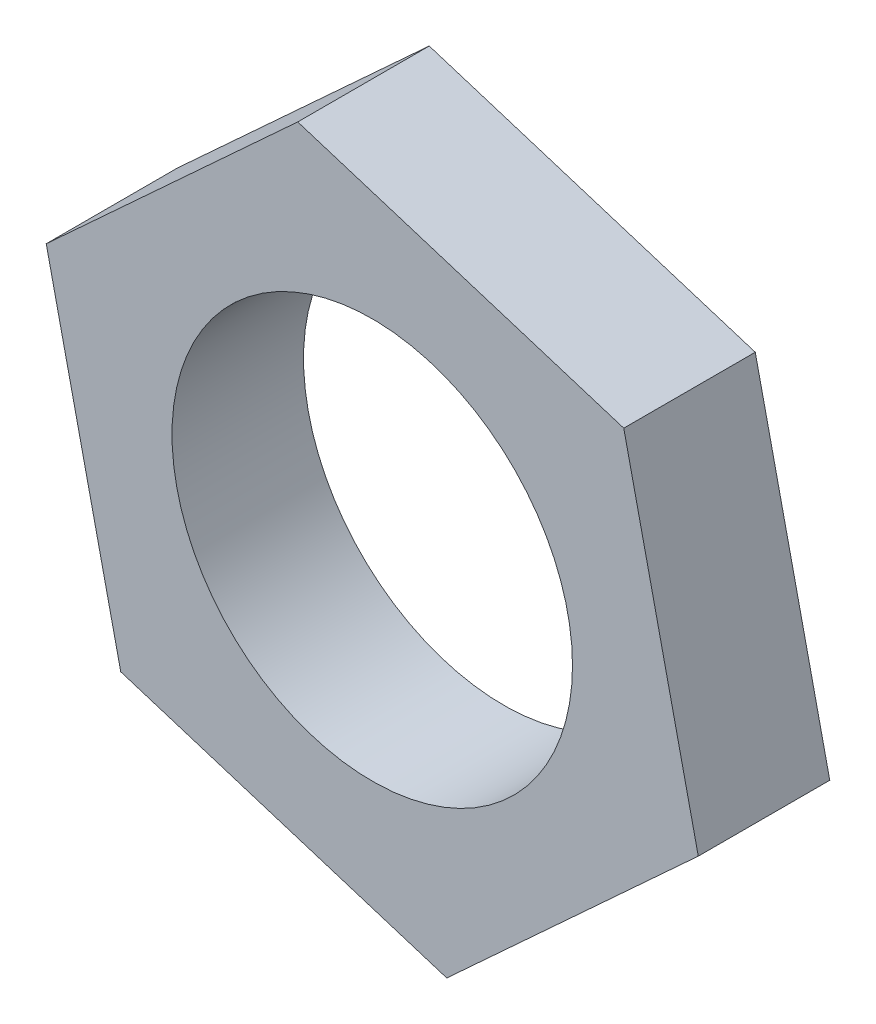
from build123d import *

# Parameters (mm, degrees)
SKETCH_1_R      = 3.35
EXTRUDE_1_DEPTH = 2.2


with BuildPart() as part:
    # 草图1 → 凸台-拉伸1 (new body)
    with BuildSketch(Plane.XY):
        Polygon((4.207542365, 3.868667374), (-1.246593042, 5.578172262), (-5.454135407, 1.709504888), (-4.207542365, -3.868667374), (1.246593042, -5.578172262), (5.454135407, -1.709504888), align=None)
        Circle(SKETCH_1_R, mode=Mode.SUBTRACT)
    extrude(amount=EXTRUDE_1_DEPTH)


solid = part.part
